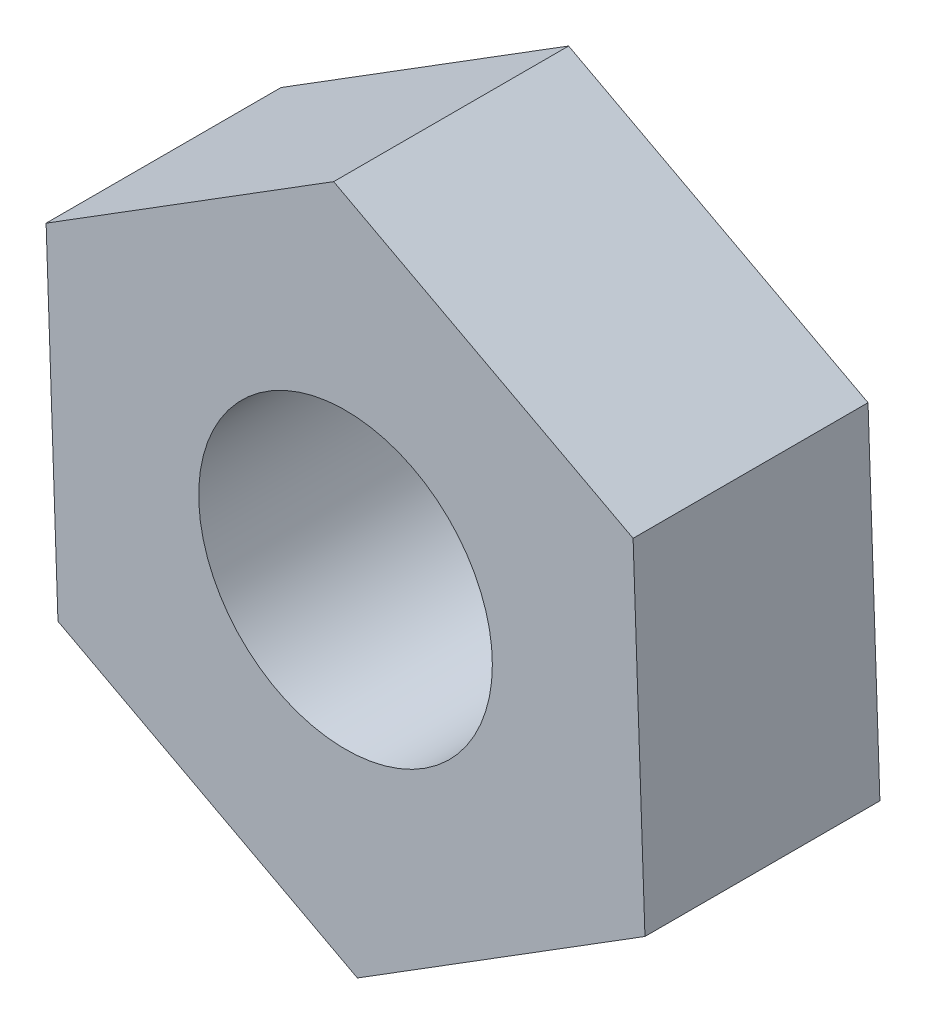
from build123d import *

# Parameters (mm, degrees)
SKETCH_1_R      = 1
EXTRUDE_1_DEPTH = 1.6


with BuildPart() as part:
    # ｽｹｯﾁ1 → ﾎﾞｽ - 押し出し1 (new body)
    with BuildSketch(Plane.XY):
        Polygon((1.958363717, 1.223987289), (-0.080822228, 2.307986374), (-2.039185945, 1.083999084), (-1.958363717, -1.223987289), (0.080822228, -2.307986374), (2.039185945, -1.083999084), align=None)
        Circle(SKETCH_1_R, mode=Mode.SUBTRACT)
    extrude(amount=EXTRUDE_1_DEPTH)


solid = part.part
